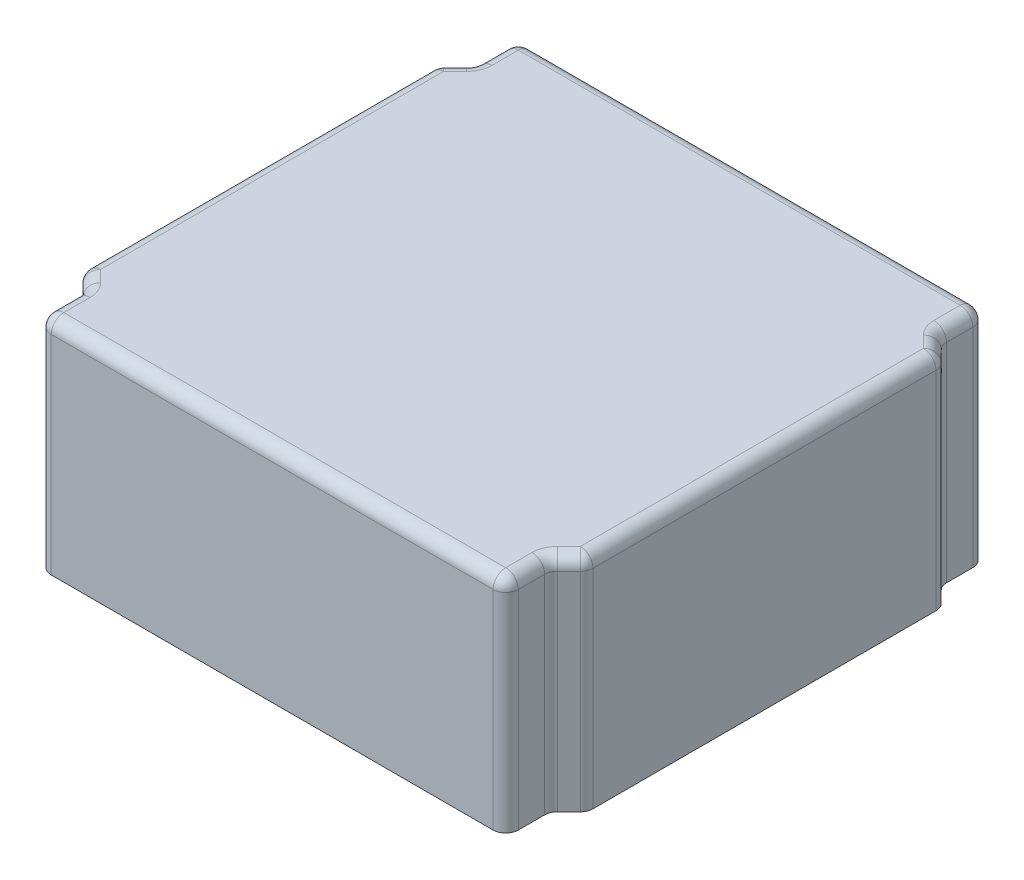
from build123d import *

# Parameters (mm, degrees)
EXTRUDE_2_DEPTH = 1.75
FILLET_1_R      = 0.1


with BuildPart() as part:
    # Эскиз1 → Бобышка-Вытянуть2 (new body)
    with BuildSketch(Plane(origin=(0, 0, 0), x_dir=(1, 0, 0), z_dir=(0, 1, 0))):
        Polygon((-1.85, 1.9), (-1.85, 1.55), (-2, 1.4), (-2, -1.4), (-1.85, -1.55), (-1.85, -1.9), (1.85, -1.9), (1.85, -1.55), (2, -1.4), (2, 1.4), (1.85, 1.55), (1.85, 1.9), align=None)
    extrude(amount=EXTRUDE_2_DEPTH)

    # Скругление1
    fillet_1_edges = [part.edges().sort_by_distance(p)[0] for p in [
        (0, 1.75, 1.9),
        (-1.85, 1.75, 1.725),
        (-1.925, 1.75, 1.475),
        (-2, 1.75, 0),
        (2, 0.875, 1.4),
        (2, 0.875, -1.4),
        (1.85, 0.875, -1.55),
        (1.85, 0.875, -1.9),
        (-1.85, 0.875, -1.9),
        (-1.85, 0.875, -1.55),
        (-2, 0.875, -1.4),
        (-2, 0.875, 1.4),
        (-1.85, 0.875, 1.55),
        (-1.85, 0.875, 1.9),
        (1.85, 0.875, 1.9),
        (1.85, 0.875, 1.55),
        (-1.925, 1.75, -1.475),
        (-1.85, 1.75, -1.725),
        (0, 1.75, -1.9),
        (1.85, 1.75, -1.725),
        (1.925, 1.75, -1.475),
        (2, 1.75, 0),
        (1.925, 1.75, 1.475),
        (1.85, 1.75, 1.725),
    ]]
    fillet(fillet_1_edges, radius=FILLET_1_R)


solid = part.part
